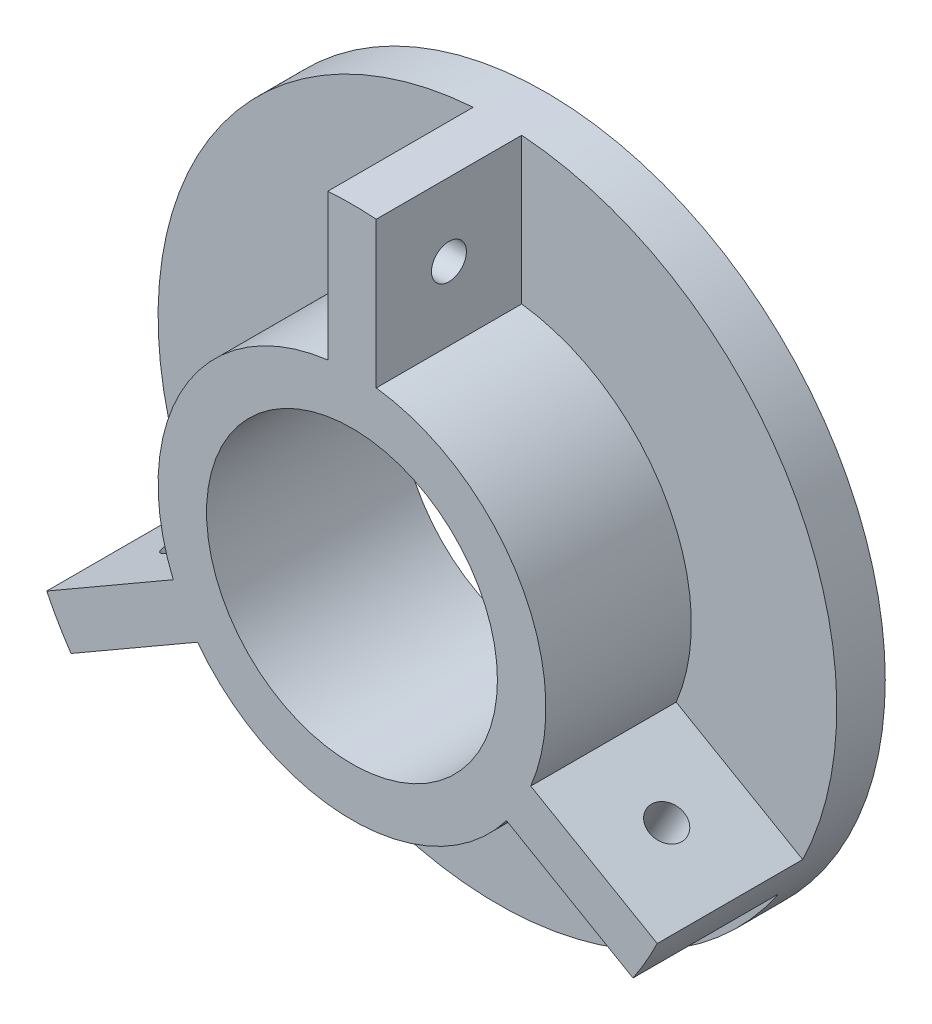
from build123d import *

# Parameters (mm, degrees)
SKETCH2_R           = 35
SKETCH2_R_2         = 15
BOSS_EXTRUDE1_DEPTH = 5
SKETCH3_R           = 19.99897621
SKETCH3_R_2         = 15
BOSS_EXTRUDE3_DEPTH = 15
CUT_EXTRUDE1_REACH  = 57.057
SKETCH4_R           = 1.8
CIRPATTERN1_COUNT   = 3


with BuildPart() as part:
    # Sketch2 → Boss-Extrude1 (new body)
    with BuildSketch(Plane.XY):
        Circle(SKETCH2_R)
        Circle(SKETCH2_R_2, mode=Mode.SUBTRACT)
    extrude(amount=BOSS_EXTRUDE1_DEPTH)

    # Sketch3 → Boss-Extrude3 (add)
    # profile 1 of 4: a face of its own
    with BuildSketch(Plane.XY.offset(5)):
        Circle(SKETCH3_R)
        Circle(SKETCH3_R_2, mode=Mode.SUBTRACT)
    # profile 2 of 4: a face of its own
    with BuildSketch(Plane.XY.offset(5)):
        with BuildLine():
            Line((-2.5, 34.910600109), (-2.5, 19.84210295))
            ThreePointArc((-2.5, 19.84210295), (0, 19.99897621), (2.5, 19.84210295))
            Line((2.5, 19.84210295), (2.5, 34.910600109))
            ThreePointArc((2.5, 34.910600109), (0, 35), (-2.5, 34.910600109))
        make_face()
    # profile 3 of 4: a face of its own
    with BuildSketch(Plane.XY.offset(5)):
        with BuildLine():
            ThreePointArc((18.433765219, -7.755987965), (17.319621448, -9.999488105), (15.933765219, -12.086114984))
            Line((15.933765219, -12.086114984), (28.983466556, -19.620363564))
            ThreePointArc((28.983466556, -19.620363564), (30.310889132, -17.5), (31.483466556, -15.290236545))
            Line((31.483466556, -15.290236545), (18.433765219, -7.755987965))
        make_face()
    # profile 4 of 4: a face of its own
    with BuildSketch(Plane.XY.offset(5)):
        with BuildLine():
            Line((-28.983466556, -19.620363564), (-15.933765219, -12.086114984))
            ThreePointArc((-15.933765219, -12.086114984), (-17.319621448, -9.999488105), (-18.433765219, -7.755987965))
            Line((-18.433765219, -7.755987965), (-31.483466556, -15.290236545))
            ThreePointArc((-31.483466556, -15.290236545), (-30.310889132, -17.5), (-28.983466556, -19.620363564))
        make_face()
    extrude(amount=BOSS_EXTRUDE3_DEPTH)

    # Sketch4 → Cut-Extrude1 (cut, up to next)
    with BuildSketch(Plane(origin=(2.5, 0, 0), x_dir=(0, 0, -1), z_dir=(1, 0, 0)), mode=Mode.PRIVATE) as cut_extrude1_sk1:
        with Locations((-12.5, 27.376351529)):
            Circle(SKETCH4_R)
    cut_extrude1_tool1 = extrude(cut_extrude1_sk1.sketch, amount=-CUT_EXTRUDE1_REACH, mode=Mode.PRIVATE) & part.part
    cut_extrude1 = cut_extrude1_tool1.solids().sort_by_distance((2.5, 27.376352, 12.5))[0]
    add(cut_extrude1, mode=Mode.SUBTRACT)

    # CirPattern1: Cut-Extrude1 ×3 about axis
    cirpattern1_axis = Axis((0, 0, 5), (0, 0, -1))
    for i in range(1, CIRPATTERN1_COUNT):
        add(cut_extrude1.rotate(cirpattern1_axis, i * 360 / CIRPATTERN1_COUNT), mode=Mode.SUBTRACT)


solid = part.part
